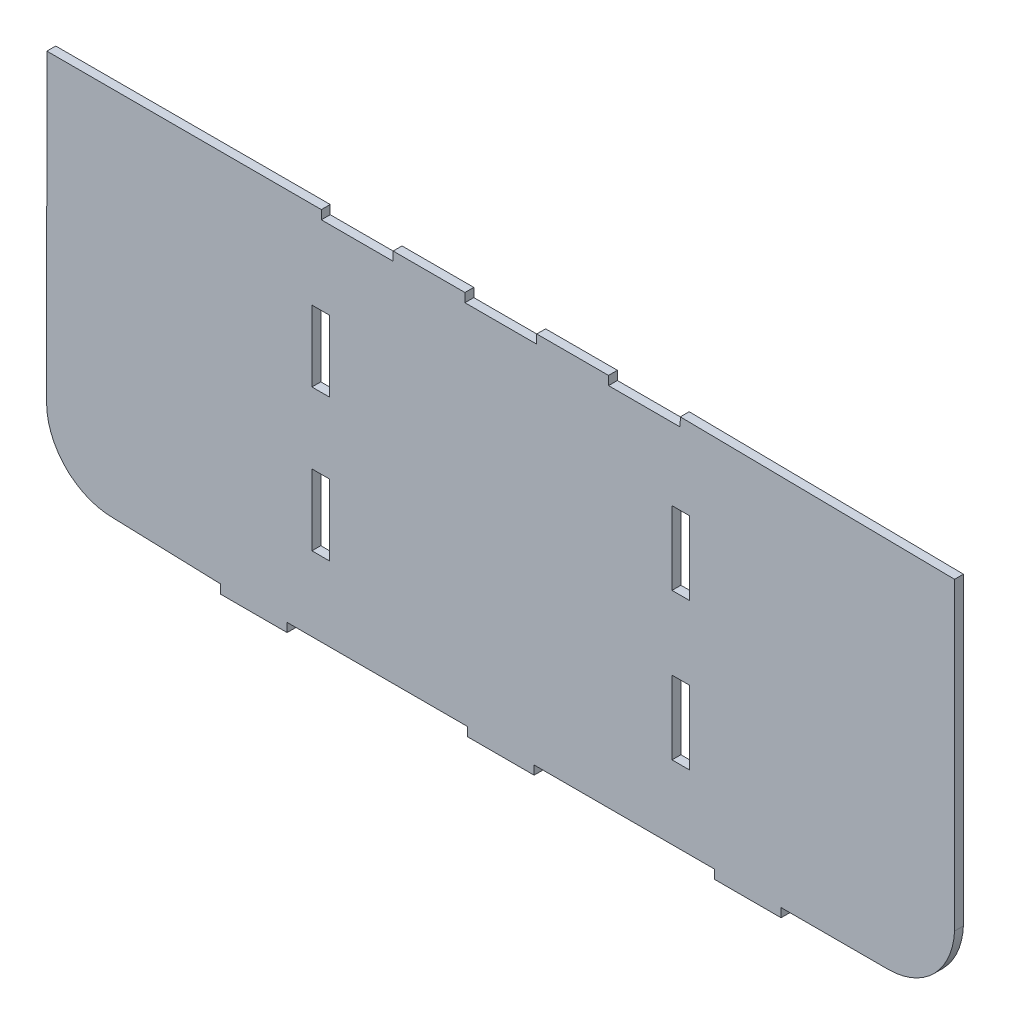
from build123d import *

# Parameters (mm, degrees)
SKETCH1_W           = 20.32
SKETCH1_H           = 81.316938585
SKETCH1_H_2         = 84.113540858
BOSS_EXTRUDE1_DEPTH = 10.16


with BuildPart() as part:
    # Sketch1 → Boss-Extrude1 (new body)
    # profile 1 of 2: a face of its own
    with BuildSketch(Plane.XY):
        with BuildLine():
            ThreePointArc((-520.699999986, 86.36), (-498.381536717, 32.478463279), (-444.5, 10.16))
            Line((-444.5, 10.16), (-321.2, 6.224098454))
            Line((-321.2, 6.224098454), (-321.2, -3.935901546))
            Line((-321.2, -3.935901546), (-245, -3.935901546))
            Line((-245, -3.935901546), (-245, 6.224098454))
            Line((-245, 6.224098454), (-38.1, 6.224098454))
            Line((-38.1, 6.224098454), (-38.1, -3.935901546))
            Line((-38.1, -3.935901546), (38.1, -3.935901546))
            Line((38.1, -3.935901546), (38.1, 6.224098454))
            Line((38.1, 6.224098454), (245, 6.224098454))
            Line((245, 6.224098454), (245, -3.935901546))
            Line((245, -3.935901546), (321.2, -3.935901546))
            Line((321.2, -3.935901546), (321.2, 6.224098454))
            Line((321.2, 6.224098454), (444.500003861, 6.224098454))
            add(Edge.make_bspline(
                [(444.500003861, 6.224098454), (516.375223264, 6.870661069), (520.046520409, 82.264098454)],
                knots=[3.150157412, 3.150157412, 3.150157412, 4.661289858, 4.661289858, 4.661289858], degree=2, weights=[1, 0.7278834, 1]))
            Line((520.046520409, 82.264098454), (520.070316171, 431.514078957))
            Line((520.070316171, 431.514078957), (205.706405146, 435.61))
            Line((205.706405146, 435.61), (205.558012439, 425.45))
            Line((205.558012439, 425.45), (123.444, 425.45))
            Line((123.444, 425.45), (123.444, 435.61))
            Line((123.444, 435.61), (41.148, 435.61))
            Line((41.148, 435.61), (41.148, 425.45))
            Line((41.148, 425.45), (-41.148, 425.45))
            Line((-41.148, 425.45), (-41.148, 435.61))
            Line((-41.148, 435.61), (-123.444, 435.61))
            Line((-123.444, 435.61), (-123.444, 425.45))
            Line((-123.444, 425.45), (-205.739999986, 425.45))
            Line((-205.739999986, 425.45), (-205.739999986, 388.35))
            Line((-205.739999986, 388.35), (-230.359692704, 388.35))
            Line((-230.359692704, 388.35), (-230.359692704, 435.61))
            Line((-230.359692704, 435.61), (-520.3601107, 435.61))
            Line((-520.3601107, 435.61), (-520.699999986, 86.36))
        make_face()
        with Locations((-206.375268781, 132.135407878)):
            Rectangle(SKETCH1_W, SKETCH1_H, mode=Mode.SUBTRACT)
        with Locations((206.375268781, 132.394409741)):
            Rectangle(SKETCH1_W, SKETCH1_H_2, mode=Mode.SUBTRACT)
        with Locations((-206.375268781, 294.769285048)):
            Rectangle(SKETCH1_W, SKETCH1_H, mode=Mode.SUBTRACT)
        with Locations((206.375268781, 300.621491457)):
            Rectangle(SKETCH1_W, SKETCH1_H_2, mode=Mode.SUBTRACT)
    # profile 2 of 2: a face of its own
    with BuildSketch(Plane.XY):
        Polygon((-205.739999986, 435.61), (-230.359692704, 435.61), (-230.359692704, 388.35), (-205.739999986, 388.35), (-205.739999986, 425.45), align=None)
    extrude(amount=BOSS_EXTRUDE1_DEPTH)


solid = part.part
